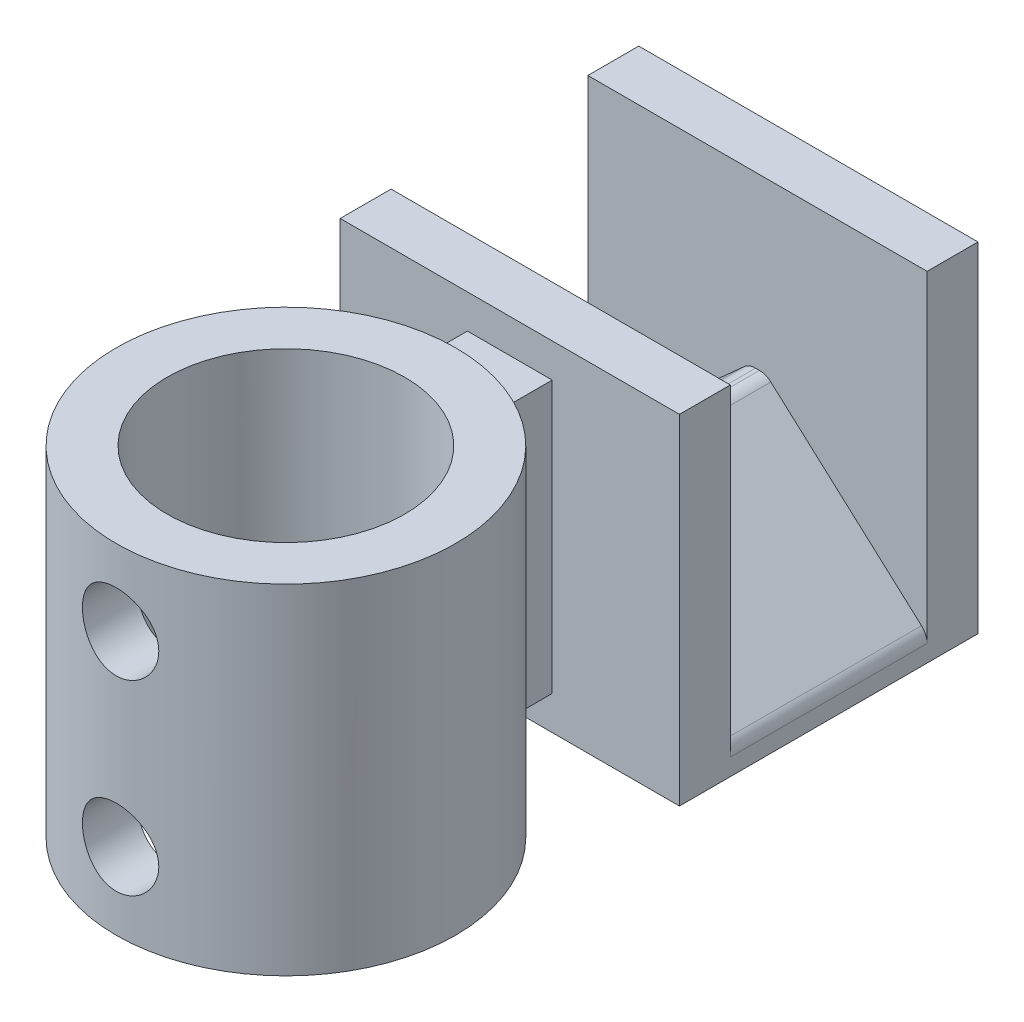
from build123d import *

# Parameters (mm, degrees)
SKETCH2_W                       = 20
SKETCH2_H                       = 10
BOSS_EXTRUDE1_DEPTH             = 5.8
CHAMFER1_SIZE                   = 9.5
CHAMFER1_SIZE2                  = 8.553838421
FILLET3_R                       = 1
SKETCH3_W                       = 20
SKETCH3_H                       = 20
BOSS_EXTRUDE2_DEPTH             = 3
BOSS_EXTRUDE3_REACH             = 22.061
SKETCH6_R                       = 10
SKETCH6_R_2                     = 7
BOSS_EXTRUDE3_DIRECTION_2_REACH = 22.061
BOSS_EXTRUDE4_REACH             = 31.381
BOSS_EXTRUDE4_END_RADIUS        = 10
SKETCH5_W                       = 5
SKETCH5_H                       = 16
CUT_EXTRUDE1_REACH              = 35.977
CUT_EXTRUDE1_END_RADIUS         = 10
SKETCH7_R                       = 2.25


with BuildPart() as part:
    # Sketch2 → Boss-Extrude1 (new, symmetric)
    with BuildSketch(Plane.XY):
        Rectangle(SKETCH2_W, SKETCH2_H)
    extrude(amount=BOSS_EXTRUDE1_DEPTH, both=True)

    # Chamfer1
    chamfer1_edges = [part.edges().sort_by_distance(p)[0] for p in [
        (-10, 5, 0),
        (10, 5, 0),
    ]]
    chamfer1_side = [part.faces().sort_by_distance(p)[0] for p in [
        (0, 5, 0),
    ]]
    chamfer(chamfer1_edges, length=CHAMFER1_SIZE, length2=CHAMFER1_SIZE2, reference=chamfer1_side[0])

    # Fillet3
    fillet3_edges = [part.edges().sort_by_distance(p)[0] for p in [
        (-0.5, 5, 0),
        (0.5, 5, 0),
        (10, -3.553838421, 0),
        (-10, -3.553838421, 0),
    ]]
    fillet(fillet3_edges, radius=FILLET3_R)

    # Sketch3 → Boss-Extrude2 (add)
    with BuildSketch(Plane.XY.offset(5.8)):
        with Locations((0, 5)):
            Rectangle(SKETCH3_W, SKETCH3_H)
    boss_extrude2 = extrude(amount=BOSS_EXTRUDE2_DEPTH)

    # Mirror1: Boss-Extrude2 across plane
    add(boss_extrude2.mirror(Plane.XY))


with BuildPart() as body_2:

    # Boss-Extrude3: up to this face of the body (flat: up to its plane)
    boss_extrude3_end = Plane(part.part.faces().sort_by_distance((0, 15, 7.3))[0])
    # Sketch6 → Boss-Extrude3 (new, up to the picked face)
    with BuildSketch(Plane(origin=(0, 0, 0), x_dir=(1, 0, 0), z_dir=(0, 1, 0)), mode=Mode.PRIVATE) as boss_extrude3_sk1:
        with Locations(Location((0, -22, 0), (0, 0, 90))):
            Circle(SKETCH6_R)
        with Locations(Location((0, -22, 0), (0, 0, 90))):
            Circle(SKETCH6_R_2, mode=Mode.SUBTRACT)
    boss_extrude3_tool1 = split(extrude(boss_extrude3_sk1.sketch, amount=BOSS_EXTRUDE3_REACH, mode=Mode.PRIVATE), bisect_by=boss_extrude3_end, keep=Keep.BOTH, mode=Mode.PRIVATE)
    add(boss_extrude3_tool1.solids().sort_by(Axis((0, 0, 31.717157), (0, 1, 0)))[0])


    # Boss-Extrude3 direction 2: up to this face of the body (flat: up to its plane)
    boss_extrude3_direction_2_end = Plane(part.part.faces().sort_by_distance((0, -5, 0))[0])
    # Sketch6 → Boss-Extrude3 direction 2 (add, up to the picked face)
    with BuildSketch(Plane(origin=(0, 0, 0), x_dir=(1, 0, 0), z_dir=(0, 1, 0)), mode=Mode.PRIVATE) as boss_extrude3_direction_2_sk1:
        with Locations(Location((0, -22, 0), (0, 0, 90))):
            Circle(SKETCH6_R)
        with Locations(Location((0, -22, 0), (0, 0, 90))):
            Circle(SKETCH6_R_2, mode=Mode.SUBTRACT)
    boss_extrude3_direction_2_tool1 = split(extrude(boss_extrude3_direction_2_sk1.sketch, amount=-BOSS_EXTRUDE3_DIRECTION_2_REACH, mode=Mode.PRIVATE), bisect_by=boss_extrude3_direction_2_end, keep=Keep.BOTH, mode=Mode.PRIVATE)
    add(boss_extrude3_direction_2_tool1.solids().sort_by(Axis((0, 0, 31.717157), (0, -1, 0)))[0])


with BuildPart() as part_1:
    add(part.part)

    add(body_2.part)  # Boss-Extrude4 merges body 2
    # Boss-Extrude4: up to this cylinder (the profile starts outside it)
    boss_extrude4_end = Plane(origin=(0, 5, 22), z_dir=(0, -1, 0)) * Cylinder(BOSS_EXTRUDE4_END_RADIUS, 83.762, mode=Mode.PRIVATE)
    # Sketch5 → Boss-Extrude4 (add, up to the surface)
    with BuildSketch(Plane.XY.offset(8.8), mode=Mode.PRIVATE) as boss_extrude4_sk1:
        with Locations((0, 5)):
            Rectangle(SKETCH5_W, SKETCH5_H)
    boss_extrude4_tool1 = extrude(boss_extrude4_sk1.sketch, amount=BOSS_EXTRUDE4_REACH, mode=Mode.PRIVATE) - boss_extrude4_end
    add(boss_extrude4_tool1.solids().sort_by_distance((0, 5, 8.8))[0])

    # Cut-Extrude1: up to this cylinder (the profile starts inside it)
    cut_extrude1_end = Plane(origin=(0, 5, 22), z_dir=(0, -1, 0)) * Cylinder(CUT_EXTRUDE1_END_RADIUS, 103.954, mode=Mode.PRIVATE)
    # Sketch7 → Cut-Extrude1 (cut, up to the surface)
    with BuildSketch(Plane.XY.offset(20), mode=Mode.PRIVATE) as cut_extrude1_sk1:
        with Locations(Location((0, 10.5, 0), (0, 0, 180))):
            Circle(SKETCH7_R)
    cut_extrude1_tool1 = extrude(cut_extrude1_sk1.sketch, amount=CUT_EXTRUDE1_REACH, mode=Mode.PRIVATE) & cut_extrude1_end
    add(cut_extrude1_tool1.solids().sort_by_distance((0, 10.5, 20))[0], mode=Mode.SUBTRACT)
    # Sketch7 → Cut-Extrude1 (cut, up to the surface)
    with BuildSketch(Plane.XY.offset(20), mode=Mode.PRIVATE) as cut_extrude1_sk2:
        with Locations(Location((0, -0.5, 0), (0, 0, 180))):
            Circle(SKETCH7_R)
    cut_extrude1_tool2 = extrude(cut_extrude1_sk2.sketch, amount=CUT_EXTRUDE1_REACH, mode=Mode.PRIVATE) & cut_extrude1_end
    add(cut_extrude1_tool2.solids().sort_by_distance((0, -0.5, 20))[0], mode=Mode.SUBTRACT)


solid = part_1.part
